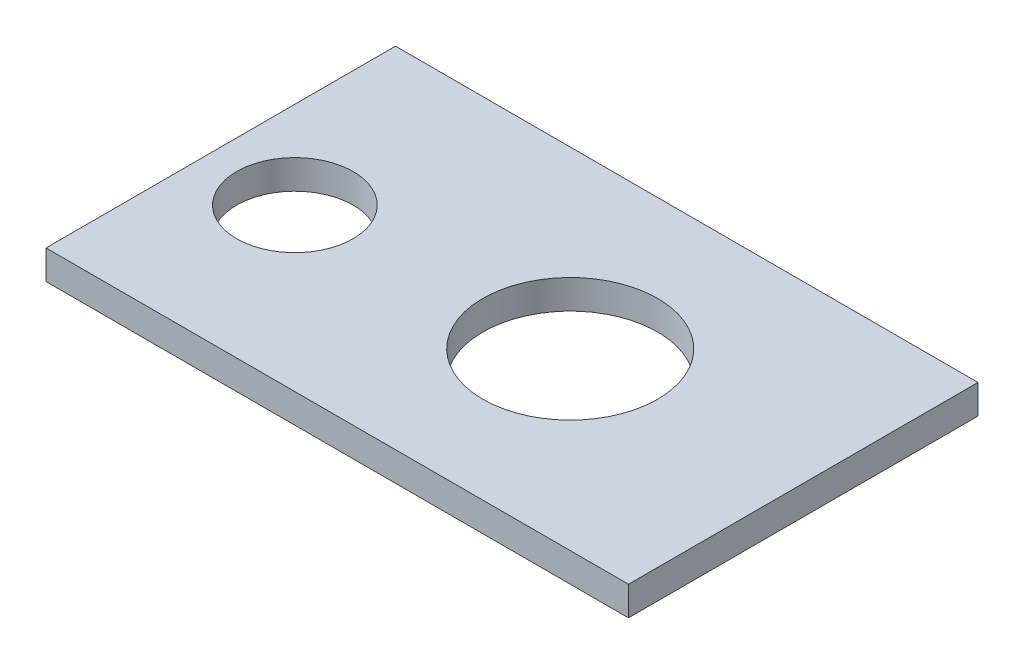
from build123d import *

# Parameters (mm, degrees)
SKETCH1_W           = 1000
SKETCH1_H           = 600
BOSS_EXTRUDE1_DEPTH = 50
SKETCH2_R           = 100
SKETCH2_R_2         = 150
CUT_EXTRUDE1_DEPTH  = 1168.261752993


with BuildPart() as part:
    # Sketch1 → Boss-Extrude1 (new body)
    with BuildSketch(Plane(origin=(0, 0, 0), x_dir=(1, 0, 0), z_dir=(0, 1, 0))):
        with Locations((500, 300)):
            Rectangle(SKETCH1_W, SKETCH1_H)
    extrude(amount=BOSS_EXTRUDE1_DEPTH)

    # Sketch2 → Cut-Extrude1 (cut, through all)
    with BuildSketch(Plane(origin=(0, 50, 0), x_dir=(1, 0, 0), z_dir=(0, 1, 0))):
        with Locations(Location((150, 277.258789034, 0), (0, 0, 270))):
            Circle(SKETCH2_R)
        with Locations(Location((600, 300, 0), (0, 0, 270))):
            Circle(SKETCH2_R_2)
    extrude(amount=-CUT_EXTRUDE1_DEPTH, mode=Mode.SUBTRACT)


solid = part.part
